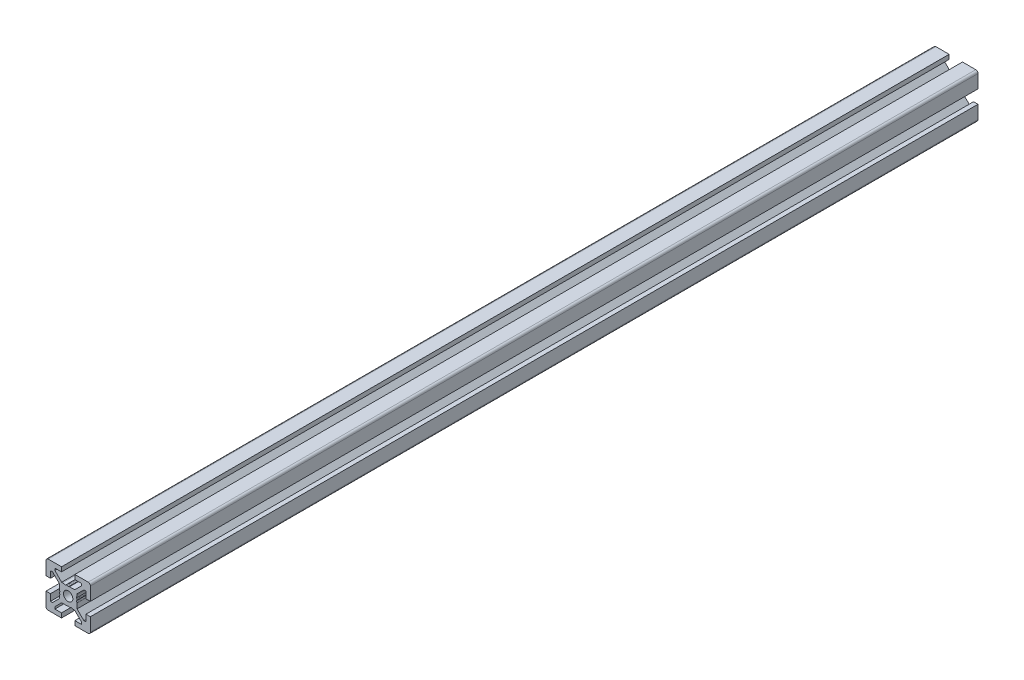
from build123d import *

# Parameters (mm, degrees)
SKETCH_1_R      = 2.1
EXTRUDE_1_DEPTH = 400


with BuildPart() as part:
    # 草圖1 → 填料-伸長1 (new body)
    with BuildSketch(Plane(origin=(0, 0, -2500), x_dir=(-1, 0, 0), z_dir=(0, 0, -1))):
        with BuildLine():
            Line((10, -3), (8, -3))
            Line((8, -3), (8, -6))
            Line((8, -6), (7.060660172, -6))
            Line((7.060660172, -6), (4, -2.939339828))
            Line((4, -2.939339828), (4, -2.5))
            Line((4, -2.5), (3.750976592, -1.218885629))
            Line((3.750976592, -1.218885629), (3.933012702, -0.903589838))
            ThreePointArc((3.933012702, -0.903589838), (4, -0.653589838), (3.933012702, -0.403589838))
            Line((3.933012702, -0.403589838), (3.7, 0))
            Line((3.7, 0), (3.933012702, 0.403589838))
            ThreePointArc((3.933012702, 0.403589838), (3.982962913, 0.524180316), (4, 0.653589838))
            Line((4, 0.653589838), (4, 2.939339828))
            Line((4, 2.939339828), (7.060660172, 6))
            Line((7.060660172, 6), (8, 6))
            Line((8, 6), (8, 3))
            Line((8, 3), (10, 3))
            Line((10, 3), (10, 9))
            ThreePointArc((10, 9), (9.707106781, 9.707106781), (9, 10))
            Line((9, 10), (3, 10))
            Line((3, 10), (3, 8))
            Line((3, 8), (6, 8))
            Line((6, 8), (6, 7.060660172))
            Line((6, 7.060660172), (2.939339828, 4))
            Line((2.939339828, 4), (2.5, 4))
            Line((2.5, 4), (1.218885629, 3.750976592))
            Line((1.218885629, 3.750976592), (0.903589838, 3.933012702))
            ThreePointArc((0.903589838, 3.933012702), (0.653589838, 4), (0.403589838, 3.933012702))
            Line((0.403589838, 3.933012702), (0, 3.7))
            Line((0, 3.7), (-0.403589838, 3.933012702))
            ThreePointArc((-0.403589838, 3.933012702), (-0.524180316, 3.982962913), (-0.653589838, 4))
            Line((-0.653589838, 4), (-2.939339828, 4))
            Line((-2.939339828, 4), (-6, 7.060660172))
            Line((-6, 7.060660172), (-6, 8))
            Line((-6, 8), (-3, 8))
            Line((-3, 8), (-3, 10))
            Line((-3, 10), (-9, 10))
            ThreePointArc((-9, 10), (-9.707106781, 9.707106781), (-10, 9))
            Line((-10, 9), (-10, 3))
            Line((-10, 3), (-8, 3))
            Line((-8, 3), (-8, 6))
            Line((-8, 6), (-7.060660172, 6))
            Line((-7.060660172, 6), (-4, 2.939339828))
            Line((-4, 2.939339828), (-4, 2.5))
            Line((-4, 2.5), (-3.750976592, 1.218885629))
            Line((-3.750976592, 1.218885629), (-3.933012702, 0.903589838))
            ThreePointArc((-3.933012702, 0.903589838), (-4, 0.653589838), (-3.933012702, 0.403589838))
            Line((-3.933012702, 0.403589838), (-3.7, 0))
            Line((-3.7, 0), (-3.933012702, -0.403589838))
            ThreePointArc((-3.933012702, -0.403589838), (-3.982962913, -0.524180316), (-4, -0.653589838))
            Line((-4, -0.653589838), (-4, -2.939339828))
            Line((-4, -2.939339828), (-7.060660172, -6))
            Line((-7.060660172, -6), (-8, -6))
            Line((-8, -6), (-8, -3))
            Line((-8, -3), (-10, -3))
            Line((-10, -3), (-10, -9))
            ThreePointArc((-10, -9), (-9.707106781, -9.707106781), (-9, -10))
            Line((-9, -10), (-3, -10))
            Line((-3, -10), (-3, -8))
            Line((-3, -8), (-6, -8))
            Line((-6, -8), (-6, -7.060660172))
            Line((-6, -7.060660172), (-2.939339828, -4))
            Line((-2.939339828, -4), (-2.5, -4))
            Line((-2.5, -4), (-1.218885629, -3.750976592))
            Line((-1.218885629, -3.750976592), (-0.903589838, -3.933012702))
            ThreePointArc((-0.903589838, -3.933012702), (-0.653589838, -4), (-0.403589838, -3.933012702))
            Line((-0.403589838, -3.933012702), (0, -3.7))
            Line((0, -3.7), (0.403589838, -3.933012702))
            ThreePointArc((0.403589838, -3.933012702), (0.524180316, -3.982962913), (0.653589838, -4))
            Line((0.653589838, -4), (2.939339828, -4))
            Line((2.939339828, -4), (6, -7.060660172))
            Line((6, -7.060660172), (6, -8))
            Line((6, -8), (3, -8))
            Line((3, -8), (3, -10))
            Line((3, -10), (9, -10))
            ThreePointArc((9, -10), (9.707106781, -9.707106781), (10, -9))
            Line((10, -9), (10, -3))
        make_face()
        with Locations(Location((0, 0, 0), (0, 0, 180))):
            Circle(SKETCH_1_R, mode=Mode.SUBTRACT)
    extrude(amount=-EXTRUDE_1_DEPTH)


solid = part.part
